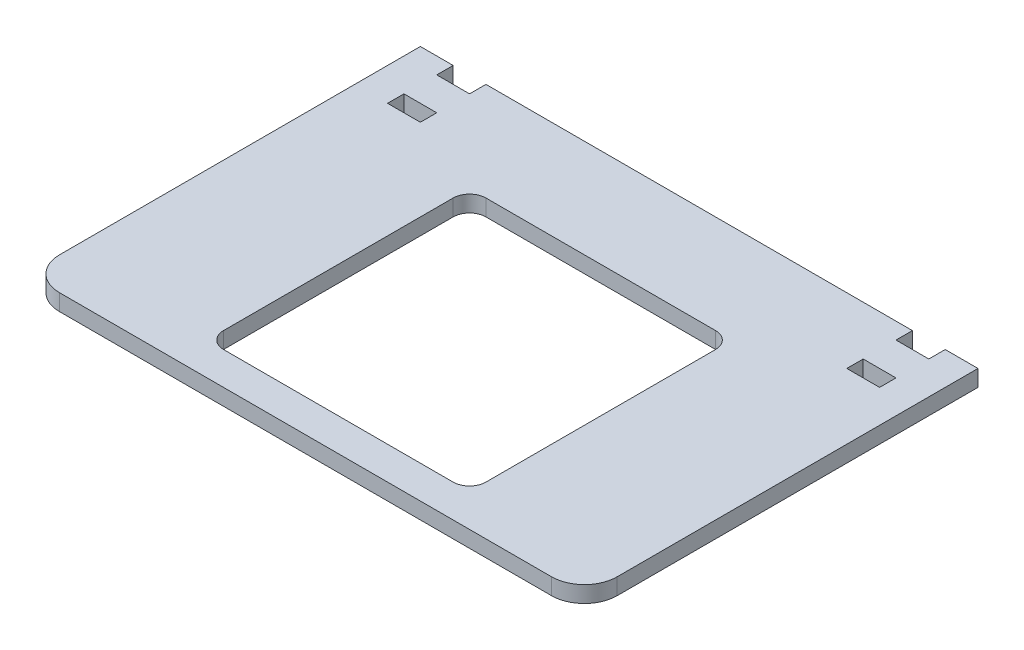
from build123d import *

# Parameters (mm, degrees)
ESQUISSE2_W                  = 215.9
ESQUISSE2_H                  = 152.4
BOSS_EXTRU_1_DEPTH           = 6.35
ENL_V_MAT_EXTRU_1_DEPTH      = 133.287433266
ENL_V_MAT_EXTRU_1_DEPTH_BACK = 133.287433266
ESQUISSE3_W                  = 12.7
ESQUISSE3_H                  = 6.35
CONG_1_R                     = 12.7
ENL_V_MAT_EXTRU_2_DEPTH      = 133.287433266


with BuildPart() as part:
    # Esquisse2 → Boss.-Extru.1 (new body)
    with BuildSketch(Plane(origin=(0, 0, 0), x_dir=(1, 0, 0), z_dir=(0, 1, 0))):
        Rectangle(ESQUISSE2_W, ESQUISSE2_H)
    extrude(amount=BOSS_EXTRU_1_DEPTH)

    # Esquisse3 → Enlèv. mat.-Extru.1 (cut, two sides: drawn at the far end of the back side and taken through both)
    with BuildSketch(Plane(origin=(0, 6.35, 0), x_dir=(1, 0, 0), z_dir=(0, 1, 0)).offset(-ENL_V_MAT_EXTRU_1_DEPTH_BACK)):
        with Locations((-88.9, 73.025)):
            Rectangle(ESQUISSE3_W, ESQUISSE3_H)
        with Locations((-88.9, 53.975)):
            Rectangle(ESQUISSE3_W, ESQUISSE3_H)
        with Locations((88.9, 53.975)):
            Rectangle(ESQUISSE3_W, ESQUISSE3_H)
        with Locations((88.9, 73.025)):
            Rectangle(ESQUISSE3_W, ESQUISSE3_H)
    extrude(amount=ENL_V_MAT_EXTRU_1_DEPTH + ENL_V_MAT_EXTRU_1_DEPTH_BACK, mode=Mode.SUBTRACT)

    # Congé1
    cong_1_edges = [part.edges().sort_by_distance(p)[0] for p in [
        (107.95, 3.175, 76.2),
        (-107.95, 3.175, 76.2),
    ]]
    fillet(cong_1_edges, radius=CONG_1_R)

    # Esquisse4 → Enlèv. mat.-Extru.2 (cut, through all)
    with BuildSketch(Plane(origin=(0, 6.35, 0), x_dir=(1, 0, 0), z_dir=(0, 1, 0))):
        with BuildLine():
            Line((-44.45, 38.1), (44.45, 38.1))
            ThreePointArc((44.45, 38.1), (48.940128061, 36.240128061), (50.8, 31.75))
            Line((50.8, 31.75), (50.8, -57.15))
            ThreePointArc((50.8, -57.15), (48.940128061, -61.640128061), (44.45, -63.5))
            Line((44.45, -63.5), (-44.45, -63.5))
            ThreePointArc((-44.45, -63.5), (-48.940128061, -61.640128061), (-50.8, -57.15))
            Line((-50.8, -57.15), (-50.8, 31.75))
            ThreePointArc((-50.8, 31.75), (-48.940128061, 36.240128061), (-44.45, 38.1))
        make_face()
    extrude(amount=-ENL_V_MAT_EXTRU_2_DEPTH, mode=Mode.SUBTRACT)


solid = part.part
